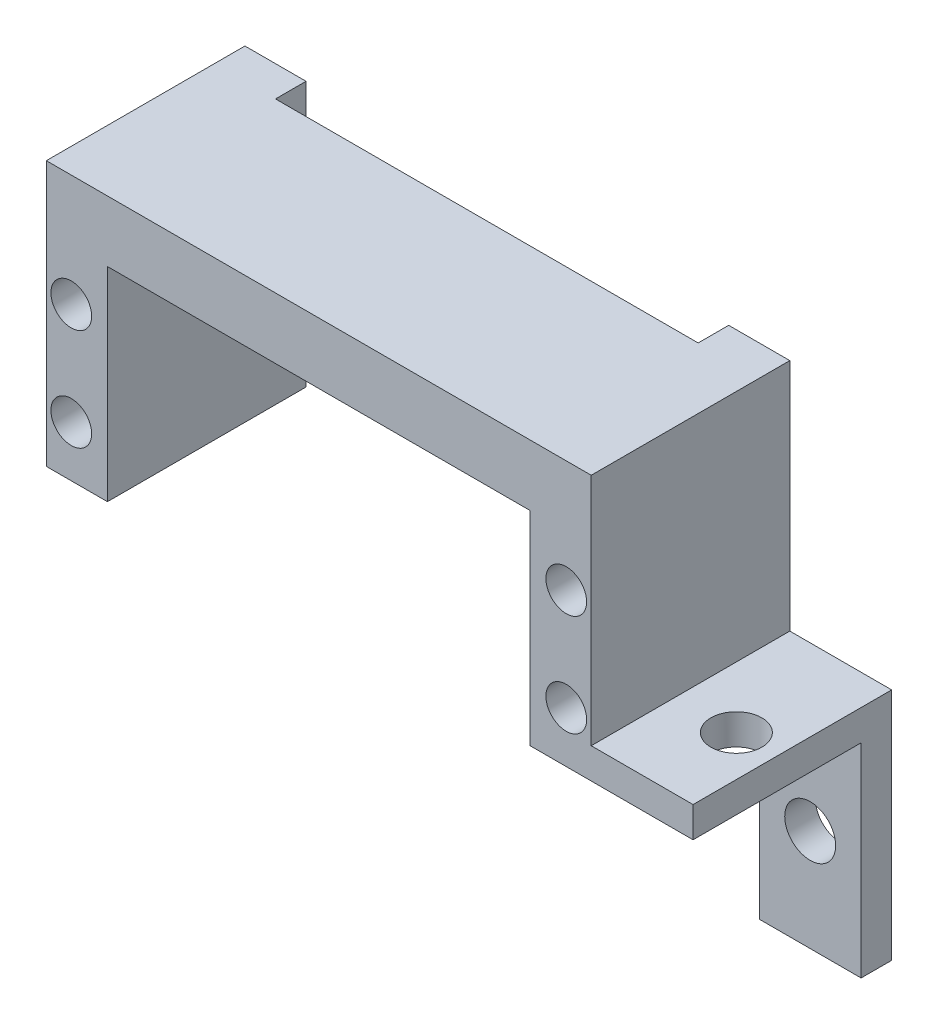
from build123d import *

# Parameters (mm, degrees)
EXTRUDE_1_DEPTH     = 16.5
SKETCH_2_R          = 2.5
CUT_EXTRUDE_1_DEPTH = 16.5
SKETCH_3_W          = 10
SKETCH_3_H          = 16.5
CUT_EXTRUDE_2_DEPTH = 3
SKETCH_4_W          = 11.896315449
SKETCH_4_H          = 29.084641161
CUT_EXTRUDE_3_DEPTH = 48.945933091
SKETCH_5_R          = 2
CUT_EXTRUDE_4_DEPTH = 48.945933091
SKETCH_6_W          = 10
SKETCH_6_H          = 23
EXTRUDE_2_DEPTH     = 3
SKETCH_7_R          = 2.5
CUT_EXTRUDE_5_DEPTH = 3
EXTRUDE_START       = 3
SKETCH_8_R          = 2
SKETCH_8_W          = 6
SKETCH_8_H          = 26
EXTRUDE_3_DEPTH     = 3
SKETCH_9_R          = 2.5
CUT_EXTRUDE_6_DEPTH = 3
SKETCH_10_W         = 10
SKETCH_10_H         = 20
CUT_EXTRUDE_7_DEPTH = 10


with BuildPart() as part:
    # 草图1 → 凸台-拉伸1 (new body)
    with BuildSketch(Plane.XY):
        Polygon((0, 0), (26.75, 0), (26.75, -20), (36.75, -20), (36.75, -26), (20.75, -26), (20.75, -6), (0, -6), (-20.75, -6), (-20.75, -26), (-36.75, -26), (-36.75, -20), (-26.75, -20), (-26.75, 0), align=None)
    extrude(amount=EXTRUDE_1_DEPTH)

    # 草图2 → 切除-拉伸1 (cut)
    with BuildSketch(Plane(origin=(0, -20, 0), x_dir=(1, 0, 0), z_dir=(0, 1, 0))):
        with Locations((32.75, -8.25)):
            Circle(SKETCH_2_R)
    extrude(amount=-CUT_EXTRUDE_1_DEPTH, mode=Mode.SUBTRACT)

    # 草图3 → 切除-拉伸2 (cut)
    with BuildSketch(Plane(origin=(0, -20, 0), x_dir=(1, 0, 0), z_dir=(0, 1, 0))):
        with Locations((31.75, -8.25)):
            Rectangle(SKETCH_3_W, SKETCH_3_H)
    extrude(amount=-CUT_EXTRUDE_2_DEPTH, mode=Mode.SUBTRACT)

    # 草图4 → 切除-拉伸3 (cut, through all)
    with BuildSketch(Plane.XY.offset(16.5)):
        with Locations((-32.698157724, -14.542320581)):
            Rectangle(SKETCH_4_W, SKETCH_4_H)
    extrude(amount=-CUT_EXTRUDE_3_DEPTH, mode=Mode.SUBTRACT)

    # 草图5 → 切除-拉伸4 (cut, through all)
    with BuildSketch(Plane(origin=(0, 0, 0), x_dir=(-1, 0, 0), z_dir=(0, 0, -1))):
        with Locations((-24.3, -11)):
            Circle(SKETCH_5_R)
        with Locations((-24.3, -21)):
            Circle(SKETCH_5_R)
        with Locations((24.3, -21)):
            Circle(SKETCH_5_R)
        with Locations((24.3, -11)):
            Circle(SKETCH_5_R)
    extrude(amount=-CUT_EXTRUDE_4_DEPTH, mode=Mode.SUBTRACT)

    # 草图6 → 凸台-拉伸2 (add)
    with BuildSketch(Plane(origin=(0, 0, 0), x_dir=(-1, 0, 0), z_dir=(0, 0, -1))):
        with Locations((-31.75, -34.5)):
            Rectangle(SKETCH_6_W, SKETCH_6_H)
    extrude(amount=EXTRUDE_2_DEPTH)

    # 草图7 → 切除-拉伸5 (cut)
    with BuildSketch(Plane(origin=(0, 0, -3), x_dir=(-1, 0, 0), z_dir=(0, 0, -1))):
        with Locations((-31.75, -36)):
            Circle(SKETCH_7_R)
    extrude(amount=-CUT_EXTRUDE_5_DEPTH, mode=Mode.SUBTRACT)

    # 草图8 → 凸台-拉伸3 (add)
    # profile 1 of 2: a face of its own
    with BuildSketch(Plane(origin=(0, 0, 0), x_dir=(-1, 0, 0), z_dir=(0, 0, -1)).offset(EXTRUDE_START)):
        Polygon((26.75, 0), (20.75, 0), (20.75, -46), (26.75, -46), (30.75, -46), (30.75, -26), (26.75, -26), align=None)
        with Locations((24.3, -21)):
            Circle(SKETCH_8_R, mode=Mode.SUBTRACT)
        with Locations((24.3, -11)):
            Circle(SKETCH_8_R, mode=Mode.SUBTRACT)
    # profile 2 of 2: a face of its own
    with BuildSketch(Plane(origin=(0, 0, 0), x_dir=(-1, 0, 0), z_dir=(0, 0, -1)).offset(EXTRUDE_START)):
        with Locations((-23.75, -13)):
            Rectangle(SKETCH_8_W, SKETCH_8_H)
        with Locations((-24.3, -11)):
            Circle(SKETCH_8_R, mode=Mode.SUBTRACT)
        with Locations((-24.3, -21)):
            Circle(SKETCH_8_R, mode=Mode.SUBTRACT)
    extrude(amount=-EXTRUDE_3_DEPTH)

    # 草图9 → 切除-拉伸6 (cut)
    with BuildSketch(Plane(origin=(0, 0, -3), x_dir=(-1, 0, 0), z_dir=(0, 0, -1))):
        with Locations((25.75, -36)):
            Circle(SKETCH_9_R)
    extrude(amount=-CUT_EXTRUDE_6_DEPTH, mode=Mode.SUBTRACT)

    # 草图10 → 切除-拉伸7 (cut)
    with BuildSketch(Plane(origin=(0, 0, -3), x_dir=(-1, 0, 0), z_dir=(0, 0, -1))):
        with Locations((25.75, -36)):
            Rectangle(SKETCH_10_W, SKETCH_10_H)
    extrude(amount=-CUT_EXTRUDE_7_DEPTH, mode=Mode.SUBTRACT)


solid = part.part
